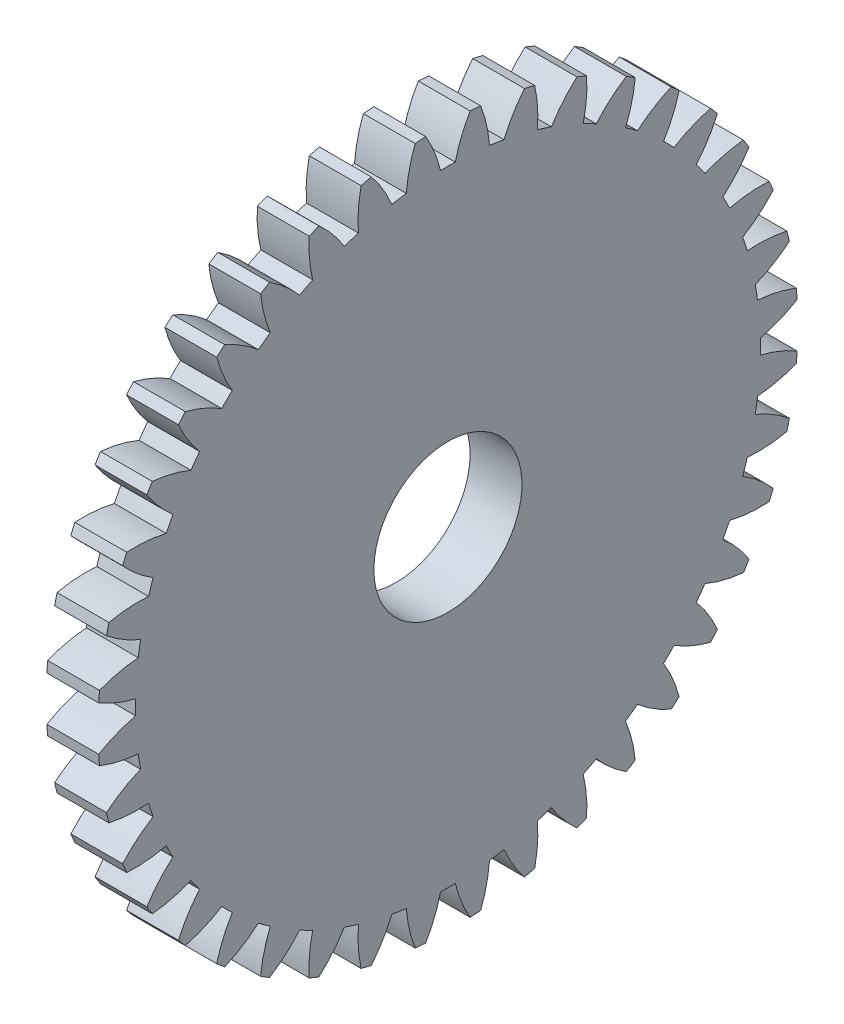
from build123d import *

# Parameters (mm, degrees)
BASPROSKE_W     = 7
BASPROSKE_H     = 47.25
TOOTHCUT_DEPTH  = 68.187238372
TEETHCUTS_COUNT = 40
TEETHCUTS_ANGLE = 351
BORSKE_R        = 10
BORE_DEPTH      = 50.0000508


with BuildPart() as part:
    # BasProSke → Base-Revolve (revolve)
    with BuildSketch(Plane(origin=(0, 0, 0), x_dir=(1, 0, 0), z_dir=(0, 1, 0)), mode=Mode.PRIVATE) as base_revolve_sk:
        with Locations((3.5, 23.625)):
            Rectangle(BASPROSKE_W, BASPROSKE_H)
    revolve(base_revolve_sk.sketch.rotate(Axis((-10, 0, 0), (1, 0, 0)), 180), axis=Axis((-10, 0, 0), (1, 0, 0)))

    # TooCutSke → ToothCut (cut, through all)
    with BuildSketch(Plane(origin=(0, 0, 0), x_dir=(0, 0, -1), z_dir=(1, 0, 0))):
        with BuildLine():
            ThreePointArc((0.995860056, 42.17474416), (0, 42.1865), (-0.995860056, 42.17474416))
            ThreePointArc((-0.995860056, 42.17474416), (-1.816530112, 44.753043542), (-3.014401659, 47.179199101))
            ThreePointArc((-3.014401659, 47.179199101), (0, 47.2754), (3.014401659, 47.179199101))
            ThreePointArc((3.014401659, 47.179199101), (1.816530112, 44.753043542), (0.995860056, 42.17474416))
        make_face()
    toothcut = extrude(amount=TOOTHCUT_DEPTH, mode=Mode.SUBTRACT)

    # TeethCuts: ToothCut ×40 about axis
    teethcuts_axis = Axis((-10, 0, 0), (1, 0, 0))
    for i in range(1, TEETHCUTS_COUNT):
        add(toothcut.rotate(teethcuts_axis, i * TEETHCUTS_ANGLE / (TEETHCUTS_COUNT - 1)), mode=Mode.SUBTRACT)

    # BorSke → Bore (cut, symmetric)
    with BuildSketch(Plane(origin=(0, 0, 0), x_dir=(0, 0, -1), z_dir=(1, 0, 0))):
        with Locations(Location((0, 0, 0), (0, 0, 180))):
            Circle(BORSKE_R)
    extrude(amount=BORE_DEPTH, both=True, mode=Mode.SUBTRACT)


solid = part.part
